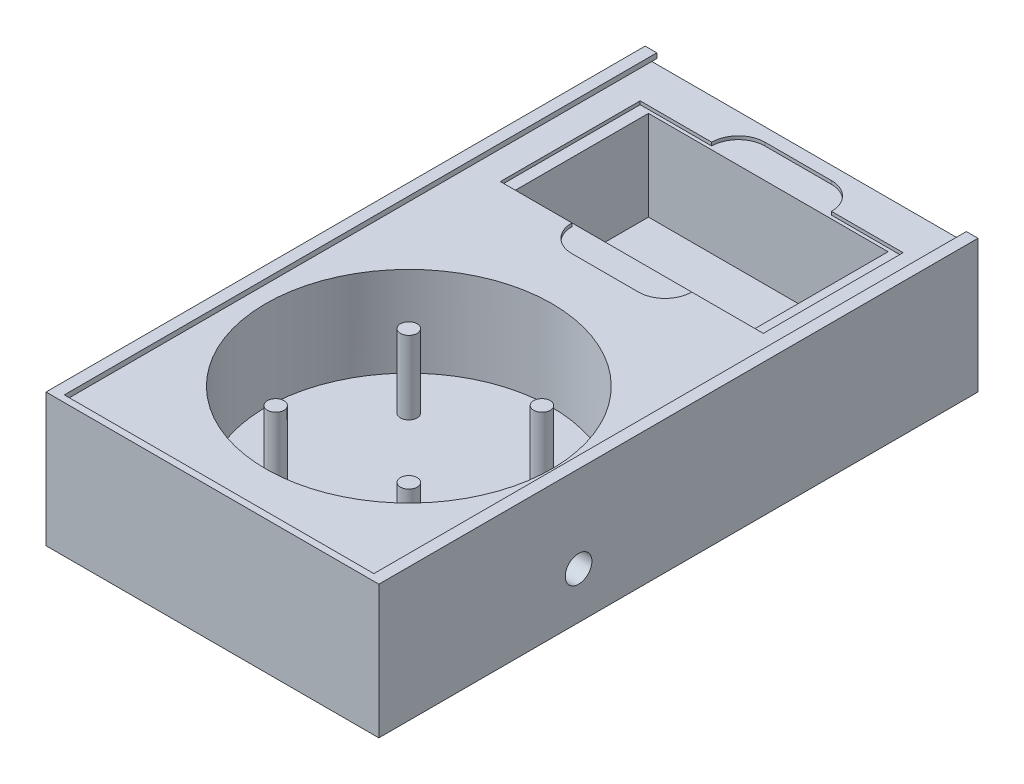
from build123d import *

# Parameters (mm, degrees)
SKETCH_1_W               = 100
SKETCH_1_H               = 180
EXTRUDE_1_DEPTH          = 40
SKETCH_2_W               = 79
SKETCH_2_H               = 42
CUT_EXTRUDE_1_DEPTH      = 4
SKETCH_3_W               = 72
SKETCH_3_H               = 40
CUT_EXTRUDE_2_DEPTH      = 27
SKETCH_2_3_R             = 43
CUT_EXTRUDE_3_DEPTH      = 30
CUT_EXTRUDE_4_REACH      = 142.357
CUT_EXTRUDE_4_END_RADIUS = 43
SKETCH_4_R               = 4
SKETCH_5_R               = 2.5
EXTRUDE_2_DEPTH          = 22
CUT_EXTRUDE_5_DEPTH      = 4
CUT_EXTRUDE_6_DEPTH      = 178


with BuildPart() as part:
    # 草图1 → 凸台-拉伸1 (new body)
    with BuildSketch(Plane(origin=(0, 0, 0), x_dir=(1, 0, 0), z_dir=(0, 1, 0))):
        Rectangle(SKETCH_1_W, SKETCH_1_H)
    extrude(amount=EXTRUDE_1_DEPTH)

    # 草图2 → 切除-拉伸1 (cut)
    with BuildSketch(Plane(origin=(0, 40, 0), x_dir=(1, 0, 0), z_dir=(0, 1, 0))):
        with Locations((0, 57)):
            Rectangle(SKETCH_2_W, SKETCH_2_H)
    extrude(amount=-CUT_EXTRUDE_1_DEPTH, mode=Mode.SUBTRACT)

    # 草图3 → 切除-拉伸2 (cut)
    with BuildSketch(Plane(origin=(0, 36, 0), x_dir=(1, 0, 0), z_dir=(0, 1, 0))):
        with Locations((0, 57)):
            Rectangle(SKETCH_3_W, SKETCH_3_H)
    extrude(amount=-CUT_EXTRUDE_2_DEPTH, mode=Mode.SUBTRACT)

    # 草图2<3> → 切除-拉伸3 (cut)
    with BuildSketch(Plane(origin=(0, 40, 0), x_dir=(1, 0, 0), z_dir=(0, 1, 0))):
        with Locations(Location((0, -31, 0), (0, 0, 270))):
            Circle(SKETCH_2_3_R)
    extrude(amount=-CUT_EXTRUDE_3_DEPTH, mode=Mode.SUBTRACT)

    # 切除-拉伸4: up to this cylinder (the profile starts outside it)
    cut_extrude_4_end = Plane(origin=(0, 14, 31), z_dir=(0, 1, 0)) * Cylinder(CUT_EXTRUDE_4_END_RADIUS, 371.714, mode=Mode.PRIVATE)
    # 草图4 → 切除-拉伸4 (cut, up to the surface)
    with BuildSketch(Plane(origin=(50, 0, 0), x_dir=(0, 0, -1), z_dir=(1, 0, 0)), mode=Mode.PRIVATE) as cut_extrude_4_sk1:
        with Locations((-30, 14)):
            Circle(SKETCH_4_R)
    cut_extrude_4_tool1 = extrude(cut_extrude_4_sk1.sketch, amount=-CUT_EXTRUDE_4_REACH, mode=Mode.PRIVATE) - cut_extrude_4_end
    add(cut_extrude_4_tool1.solids().sort_by_distance((50, 14, 30))[0], mode=Mode.SUBTRACT)

    # 草图5 → 凸台-拉伸2 (add)
    with BuildSketch(Plane(origin=(0, 10, 0), x_dir=(1, 0, 0), z_dir=(0, 1, 0))):
        with Locations(Location((-20, -11, 0), (0, 0, 270))):
            Circle(SKETCH_5_R)
        with Locations(Location((20, -11, 0), (0, 0, 90))):
            Circle(SKETCH_5_R)
        with Locations(Location((-20, -51, 0), (0, 0, 90))):
            Circle(SKETCH_5_R)
        with Locations(Location((20, -51, 0), (0, 0, 270))):
            Circle(SKETCH_5_R)
    extrude(amount=EXTRUDE_2_DEPTH)

    # 草图6 → 切除-拉伸5 (cut)
    with BuildSketch(Plane(origin=(0, 40, 0), x_dir=(1, 0, 0), z_dir=(0, 1, 0))):
        with BuildLine():
            Line((-10, 86), (10, 86))
            ThreePointArc((10, 86), (18, 78), (10, 70))
            Line((10, 70), (-10, 70))
            ThreePointArc((-10, 70), (-18, 78), (-10, 86))
        make_face()
        with BuildLine():
            Line((-10, 28), (10, 28))
            ThreePointArc((10, 28), (18, 36), (10, 44))
            Line((10, 44), (-10, 44))
            ThreePointArc((-10, 44), (-18, 36), (-10, 28))
        make_face()
    extrude(amount=-CUT_EXTRUDE_5_DEPTH, mode=Mode.SUBTRACT)

    # 草图8 → 切除-拉伸6 (cut)
    with BuildSketch(Plane(origin=(0, 0, -90), x_dir=(-1, 0, 0), z_dir=(0, 0, -1))):
        Polygon((0, 40), (0, 37), (48.5, 37), (48.5, 38.5), (46.5, 38.5), (46.5, 40), align=None)
        Polygon((-48.5, 37), (0, 37), (0, 40), (-46.5, 40), (-46.5, 38.5), (-48.5, 38.5), align=None)
    extrude(amount=-CUT_EXTRUDE_6_DEPTH, mode=Mode.SUBTRACT)


solid = part.part
